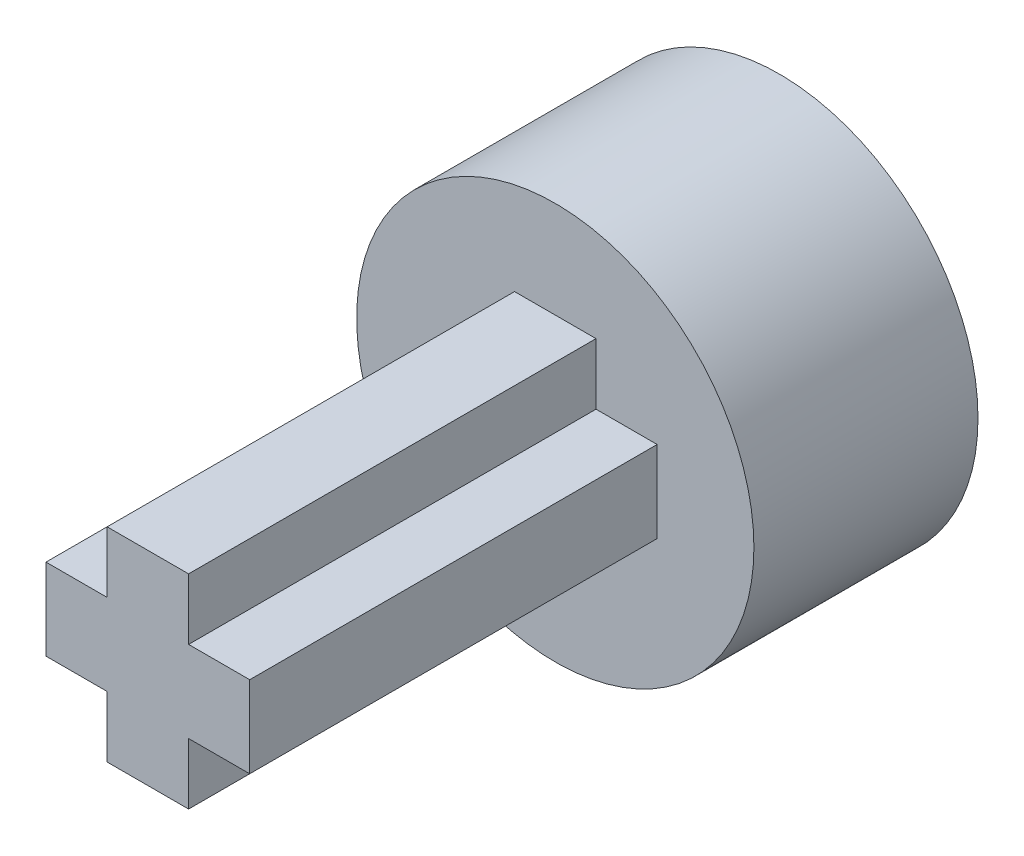
from build123d import *

# Parameters (mm, degrees)
SKETCH1_R           = 4.875
SKETCH1_R_2         = 2.875
BOSS_EXTRUDE1_DEPTH = 3.5
SKETCH2_R           = 4.875
BOSS_EXTRUDE2_DEPTH = 2
CHAMFER1_SIZE       = 0.5
BOSS_EXTRUDE3_DEPTH = 10


with BuildPart() as part:
    # Sketch1 → Boss-Extrude1 (new body)
    with BuildSketch(Plane.XY):
        Circle(SKETCH1_R)
        Circle(SKETCH1_R_2, mode=Mode.SUBTRACT)
    extrude(amount=BOSS_EXTRUDE1_DEPTH)

    # Sketch2 → Boss-Extrude2 (add)
    with BuildSketch(Plane.XY.offset(3.5)):
        Circle(SKETCH2_R)
    extrude(amount=BOSS_EXTRUDE2_DEPTH)

    # Chamfer1
    chamfer1_edges = [part.edges().sort_by_distance(p)[0] for p in [
        (-2.875, 0, 0),
    ]]
    chamfer(chamfer1_edges, length=CHAMFER1_SIZE)

    # Sketch3 → Boss-Extrude3 (add)
    with BuildSketch(Plane.XY.offset(5.5)):
        Polygon((-1, 2.5), (1, 2.5), (1, 1), (2.5, 1), (2.5, -1), (1, -1), (1, -2.5), (-1, -2.5), (-1, -1), (-2.5, -1), (-2.5, 1), (-1, 1), align=None)
    extrude(amount=BOSS_EXTRUDE3_DEPTH)


solid = part.part
